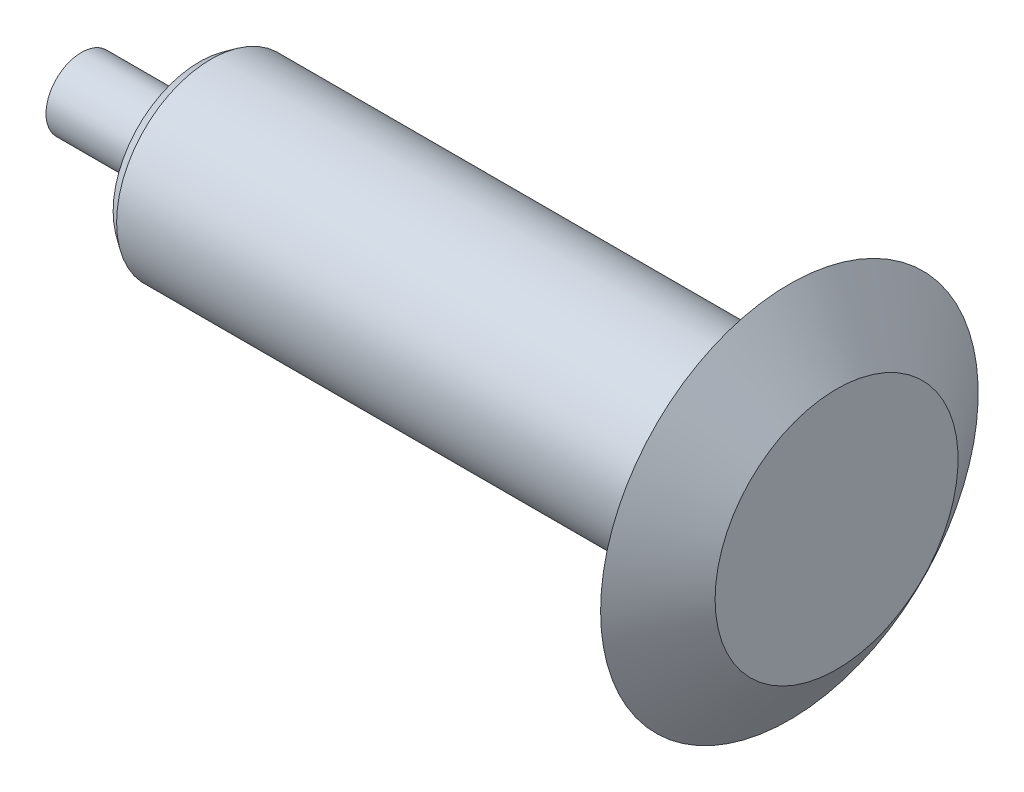
from build123d import *


with BuildPart() as part:
    # Croquis1 → Revolución1 (revolve)
    with BuildSketch(Plane.XY, mode=Mode.PRIVATE) as revoluci_n1_sk:
        Polygon((0, 0), (0, 25.742133337), (-10, 40), (-10, 25.742133337), (-18.187057148, 20), (-132.543882856, 20), (-135, 18.277359999), (-135, 7.5), (-160, 7.5), (-160, 0), align=None)
    revolve(revoluci_n1_sk.sketch.rotate(Axis((-160, 0, 0), (1, 0, 0)), 90), axis=Axis((-160, 0, 0), (1, 0, 0)))


solid = part.part
